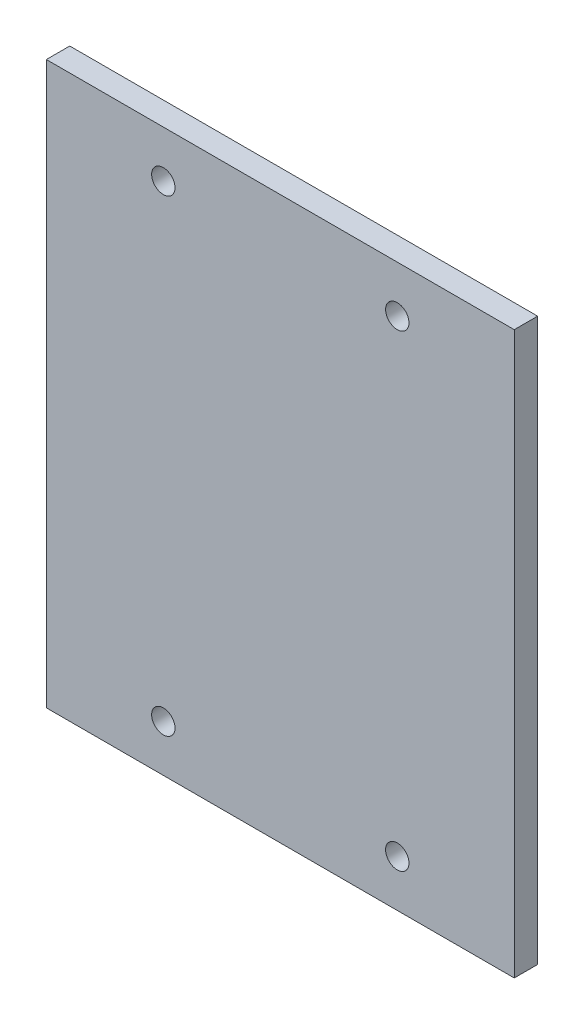
from build123d import *

# Parameters (mm, degrees)
SKETCH1_W           = 127
SKETCH1_H           = 152.4
SKETCH1_R           = 3.175
BOSS_EXTRUDE1_DEPTH = 6.35


with BuildPart() as part:
    # Sketch1 → Boss-Extrude1 (new body)
    with BuildSketch(Plane.XY):
        Rectangle(SKETCH1_W, SKETCH1_H)
        with Locations((-31.75, -63.5)):
            Circle(SKETCH1_R, mode=Mode.SUBTRACT)
        with Locations((31.75, -63.5)):
            Circle(SKETCH1_R, mode=Mode.SUBTRACT)
        with Locations((31.75, 63.5)):
            Circle(SKETCH1_R, mode=Mode.SUBTRACT)
        with Locations((-31.75, 63.5)):
            Circle(SKETCH1_R, mode=Mode.SUBTRACT)
    extrude(amount=BOSS_EXTRUDE1_DEPTH)


solid = part.part
